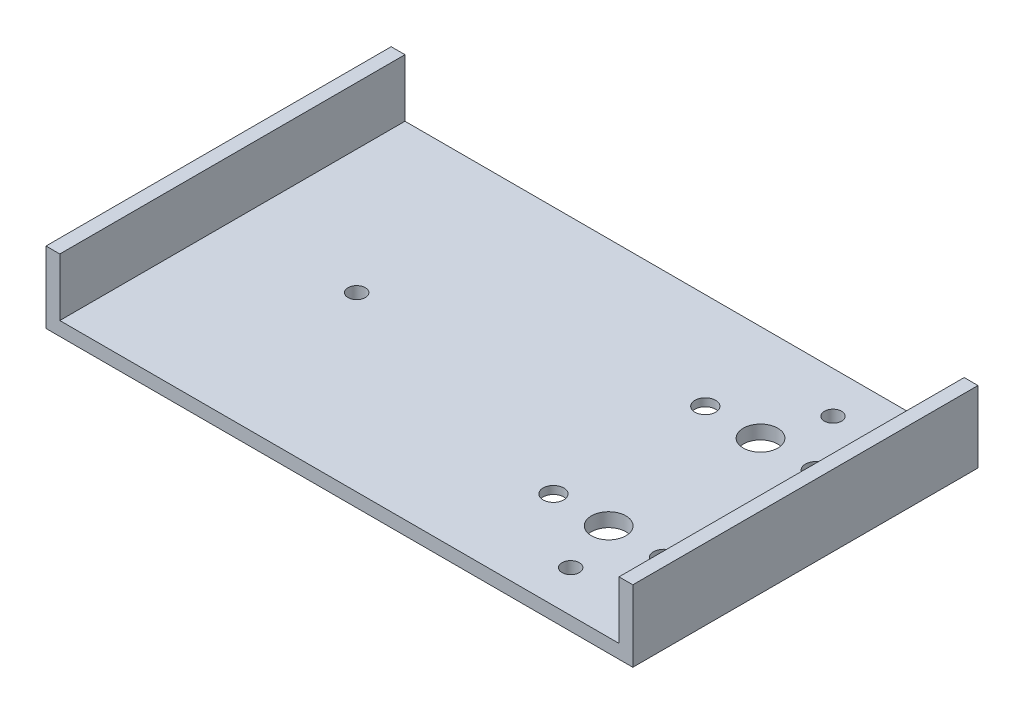
from build123d import *

# Parameters (mm, degrees)
EXTRUDE_1_DEPTH     = 100
SKETCH_2_R          = 5
SKETCH_2_R_2        = 2.5
SKETCH_2_R_3        = 3
CUT_EXTRUDE_1_DEPTH = 4
CHAMFER_3_SIZE      = 3
CHAMFER_3_SIZE2     = 1.732050808
CHAMFER_4_SIZE      = 3
CHAMFER_4_SIZE2     = 1.732050808
CHAMFER_5_SIZE      = 3
CHAMFER_5_SIZE2     = 1.732050808
CHAMFER_6_SIZE      = 3
CHAMFER_6_SIZE2     = 1.732050808


with BuildPart() as part:
    # Эскиз1 → Бобышка-Вытянуть1 (new body)
    with BuildSketch(Plane.XY):
        Polygon((0, 0), (170, 0), (170, 20.7), (166, 20.7), (166, 4), (4, 4), (4, 20.7), (0, 20.7), align=None)
    extrude(amount=EXTRUDE_1_DEPTH)

    # Эскиз2 → Вырез-Вытянуть1 (cut)
    with BuildSketch(Plane.XZ):
        with Locations(Location((135, 72, 0), (0, 0, 270))):
            Circle(SKETCH_2_R)
        with Locations(Location((135, 28, 0), (0, 0, 270))):
            Circle(SKETCH_2_R)
        with Locations(Location((40, 50, 0), (0, 0, 270))):
            Circle(SKETCH_2_R_2)
        with Locations(Location((160, 88, 0), (0, 0, 270))):
            Circle(SKETCH_2_R_2)
        with Locations(Location((140, 88, 0), (0, 0, 270))):
            Circle(SKETCH_2_R_2)
        with Locations(Location((160, 12, 0), (0, 0, 270))):
            Circle(SKETCH_2_R_2)
        with Locations(Location((140, 12, 0), (0, 0, 270))):
            Circle(SKETCH_2_R_2)
        with Locations(Location((151, 28, 0), (0, 0, 270))):
            Circle(SKETCH_2_R_3)
        with Locations(Location((119, 28, 0), (0, 0, 270))):
            Circle(SKETCH_2_R_3)
        with Locations(Location((151, 72, 0), (0, 0, 270))):
            Circle(SKETCH_2_R_3)
        with Locations(Location((119, 72, 0), (0, 0, 270))):
            Circle(SKETCH_2_R_3)
    extrude(amount=-CUT_EXTRUDE_1_DEPTH, mode=Mode.SUBTRACT)

    # Фаска3
    chamfer_3_edges = [part.edges().sort_by_distance(p)[0] for p in [
        (151, 0, 75),
    ]]
    chamfer_3_side = [part.faces().sort_by_distance(p)[0] for p in [
        (83.933938281, 0, 50),
    ]]
    chamfer(chamfer_3_edges, length=CHAMFER_3_SIZE, length2=CHAMFER_3_SIZE2, reference=chamfer_3_side[0])

    # Фаска4
    chamfer_4_edges = [part.edges().sort_by_distance(p)[0] for p in [
        (119, 0, 75),
    ]]
    chamfer_4_side = [part.faces().sort_by_distance(p)[0] for p in [
        (83.590141536, 0, 49.887222715),
    ]]
    chamfer(chamfer_4_edges, length=CHAMFER_4_SIZE, length2=CHAMFER_4_SIZE2, reference=chamfer_4_side[0])

    # Фаска5
    chamfer_5_edges = [part.edges().sort_by_distance(p)[0] for p in [
        (119, 0, 31),
    ]]
    chamfer_5_side = [part.faces().sort_by_distance(p)[0] for p in [
        (83.407686787, 0, 49.773283224),
    ]]
    chamfer(chamfer_5_edges, length=CHAMFER_5_SIZE, length2=CHAMFER_5_SIZE2, reference=chamfer_5_side[0])

    # Фаска6
    chamfer_6_edges = [part.edges().sort_by_distance(p)[0] for p in [
        (151, 0, 31),
    ]]
    chamfer_6_side = [part.faces().sort_by_distance(p)[0] for p in [
        (83.223342048, 0, 49.88605449),
    ]]
    chamfer(chamfer_6_edges, length=CHAMFER_6_SIZE, length2=CHAMFER_6_SIZE2, reference=chamfer_6_side[0])


solid = part.part
